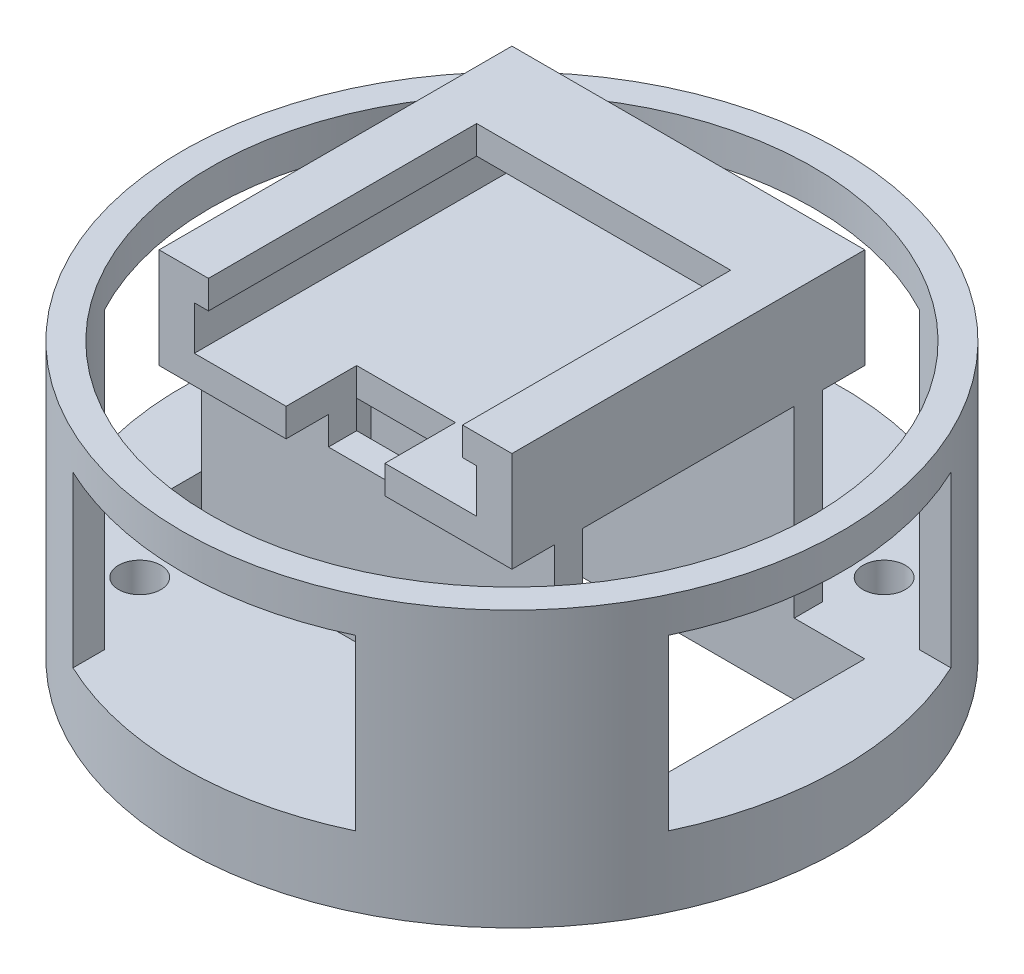
from build123d import *
from build123d.topology import SkipClean

# Parameters (mm, degrees)
ESQUISSE1_R                  = 23.35
BOSS_EXTRU_1_DEPTH           = 5
ESQUISSE9_W                  = 35
ESQUISSE9_H                  = 15
ESQUISSE9_R                  = 1.5
ESQUISSE9_R_2                = 2
ESQUISSE9_R_3                = 2.25
ENL_V_MAT_EXTRU_2_DEPTH      = 5
ESQUISSE9_3_W                = 25
ESQUISSE9_3_H                = 2
BOSS_EXTRU_2_DEPTH           = 15
BOSS_EXTRU_3_DEPTH           = 2
BOSS_EXTRU_4_DEPTH           = 3.1
BOSS_EXTRU_5_DEPTH           = 2
BOSS_EXTRU_6_DEPTH           = 12
ESQUISSE15_R                 = 23.35
ESQUISSE15_R_2               = 21.35
BOSS_EXTRU_7_DEPTH           = 2.5
ENL_V_MAT_EXTRU_4_DEPTH      = 39.606281872
ENL_V_MAT_EXTRU_4_DEPTH_BACK = 4
ESQUISSE16_W                 = 7
ESQUISSE16_H                 = 5


with BuildPart() as part:
    # Esquisse1 → Boss.-Extru.1 (new body)
    with BuildSketch(Plane(origin=(0, 0, 0), x_dir=(1, 0, 0), z_dir=(0, 1, 0))):
        Circle(ESQUISSE1_R)
    extrude(amount=BOSS_EXTRU_1_DEPTH)

    # Esquisse9 → Enlèv. mat.-Extru.2 (cut)
    with BuildSketch(Plane(origin=(0, 5, 0), x_dir=(1, 0, 0), z_dir=(0, 1, 0))):
        Rectangle(ESQUISSE9_W, ESQUISSE9_H)
        with Locations((-13.185409426, 13.185409426)):
            Circle(ESQUISSE9_R)
        with Locations((13.185409426, 13.185409426)):
            Circle(ESQUISSE9_R)
        with Locations((13.185409426, -13.185409426)):
            Circle(ESQUISSE9_R)
        with Locations((-13.185409426, -13.185409426)):
            Circle(ESQUISSE9_R)
        with Locations((0, 15.303635433)):
            Circle(ESQUISSE9_R_2)
        with Locations((-7, 15.303635433)):
            Circle(ESQUISSE9_R_3)
    extrude(amount=-ENL_V_MAT_EXTRU_2_DEPTH, mode=Mode.SUBTRACT)

    # Esquisse9<3> → Boss.-Extru.2 (add)
    with BuildSketch(Plane(origin=(0, 5, 0), x_dir=(1, 0, 0), z_dir=(0, 1, 0))):
        with Locations((0, 8.5)):
            Rectangle(ESQUISSE9_3_W, ESQUISSE9_3_H)
        with Locations((0, -8.5)):
            Rectangle(ESQUISSE9_3_W, ESQUISSE9_3_H)
    extrude(amount=BOSS_EXTRU_2_DEPTH)

    # Esquisse11 → Boss.-Extru.3 (add)
    with BuildSketch(Plane(origin=(0, 20, 0), x_dir=(1, 0, 0), z_dir=(0, 1, 0))):
        Polygon((-12.5, 9.5), (-12.5, -9.5), (-12.5, -12.5), (12.5, -12.5), (12.5, 12.5), (-12.5, 12.5), align=None)
    extrude(amount=-BOSS_EXTRU_3_DEPTH)

    # Esquisse12 → Boss.-Extru.4 (add)
    with BuildSketch(Plane(origin=(0, 20, 0), x_dir=(1, 0, 0), z_dir=(0, 1, 0))):
        Polygon((-12.5, -12.5), (-10, -12.5), (-10, 10), (10, 10), (10, -12.5), (12.5, -12.5), (12.5, 12.5), (-12.5, 12.5), align=None)
    extrude(amount=BOSS_EXTRU_4_DEPTH)

    # Esquisse13 → Boss.-Extru.5 (add)
    with BuildSketch(Plane(origin=(0, 23.1, 0), x_dir=(1, 0, 0), z_dir=(0, 1, 0))):
        Polygon((-9, -12.5), (-9, 6.5), (9, 6.5), (9, -12.5), (12.5, -12.5), (12.5, 12.5), (-12.5, 12.5), (-12.5, -12.5), align=None)
    extrude(amount=BOSS_EXTRU_5_DEPTH)

    # Esquisse14 → Boss.-Extru.6 (add)
    with BuildSketch(Plane(origin=(0, 5, 0), x_dir=(1, 0, 0), z_dir=(0, 1, 0))):
        with BuildLine():
            ThreePointArc((-10, 21.100296206), (-16.510943341, 16.510943341), (-21.100296206, 10))
            Line((-21.100296206, 10), (-18.863257937, 10))
            ThreePointArc((-18.863257937, 10), (-15.096729778, 15.096729778), (-10, 18.863257937))
            Line((-10, 18.863257937), (-10, 21.100296206))
        make_face()
        with BuildLine():
            Line((-18.863257937, -10), (-21.100296206, -10))
            ThreePointArc((-21.100296206, -10), (-16.510943341, -16.510943341), (-10, -21.100296206))
            Line((-10, -21.100296206), (-10, -18.863257937))
            ThreePointArc((-10, -18.863257937), (-15.096729778, -15.096729778), (-18.863257937, -10))
        make_face()
        with BuildLine():
            ThreePointArc((21.100296206, 10), (16.510943341, 16.510943341), (10, 21.100296206))
            Line((10, 21.100296206), (10, 18.863257937))
            ThreePointArc((10, 18.863257937), (15.096729778, 15.096729778), (18.863257937, 10))
            Line((18.863257937, 10), (21.100296206, 10))
        make_face()
        with BuildLine():
            Line((10, -18.863257937), (10, -21.100296206))
            ThreePointArc((10, -21.100296206), (16.510943341, -16.510943341), (21.100296206, -10))
            Line((21.100296206, -10), (18.863257937, -10))
            ThreePointArc((18.863257937, -10), (15.096729778, -15.096729778), (10, -18.863257937))
        make_face()
    extrude(amount=BOSS_EXTRU_6_DEPTH)

    # Esquisse15 → Boss.-Extru.7 (add)
    with SkipClean():  # the faces are left unmerged after this step: merging them gives an invalid solid
        with BuildSketch(Plane(origin=(0, 17, 0), x_dir=(1, 0, 0), z_dir=(0, 1, 0))):
            Circle(ESQUISSE15_R)
            Circle(ESQUISSE15_R_2, mode=Mode.SUBTRACT)
        extrude(amount=BOSS_EXTRU_7_DEPTH)

    # Esquisse16 → Enlèv. mat.-Extru.4 (cut, two sides: drawn at the far end of the back side and taken through both)
    with SkipClean():  # the faces are left unmerged after this step: merging them gives an invalid solid
        with BuildSketch(Plane(origin=(0, 20, 0), x_dir=(1, 0, 0), z_dir=(0, 1, 0)).offset(-ENL_V_MAT_EXTRU_4_DEPTH_BACK)):
            with Locations((0, -10)):
                Rectangle(ESQUISSE16_W, ESQUISSE16_H)
        extrude(amount=ENL_V_MAT_EXTRU_4_DEPTH + ENL_V_MAT_EXTRU_4_DEPTH_BACK, mode=Mode.SUBTRACT)


solid = part.part
